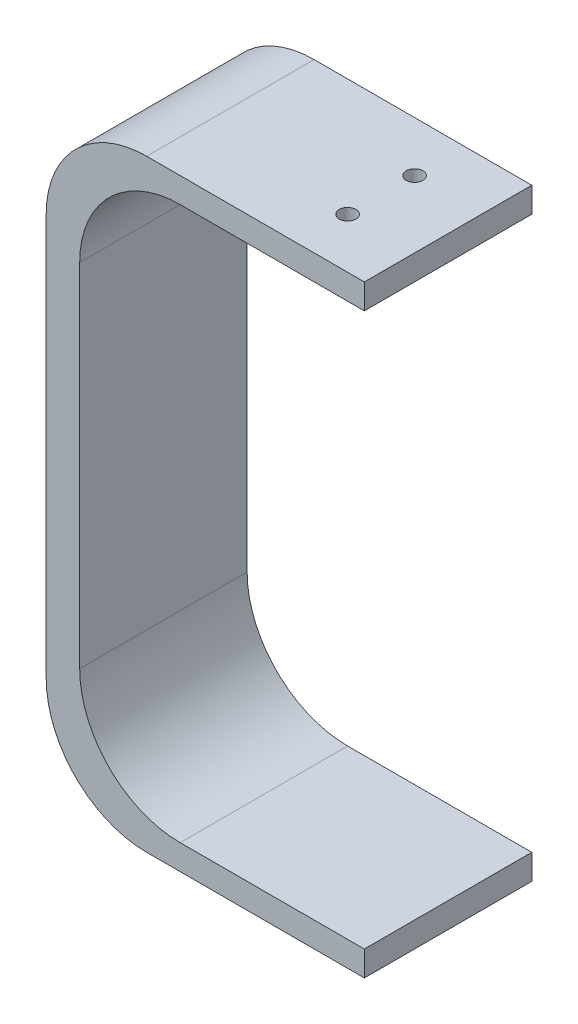
from build123d import *

# Parameters (mm, degrees)
BOSS_EXTRUDE1_DEPTH = 50
SKETCH3_R           = 2.5
CUT_EXTRUDE1_DEPTH  = 24


with BuildPart() as part:
    # Sketch1 → Boss-Extrude1 (new body)
    with BuildSketch(Plane.XY):
        with BuildLine():
            Line((-20, -165), (0, -165))
            Line((0, -165), (0, -172.5))
            Line((0, -172.5), (-51.3765108, -172.5))
            Line((-51.3765108, -172.5), (-65, -172.5))
            ThreePointArc((-65, -172.5), (-86.213203436, -163.713203436), (-95, -142.5))
            Line((-95, -142.5), (-95, -22.5))
            ThreePointArc((-95, -22.5), (-86.213203436, -1.286796564), (-65, 7.5))
            Line((-65, 7.5), (-55, 7.5))
            Line((-55, 7.5), (0, 7.5))
            Line((0, 7.5), (0, 0))
            Line((0, 0), (-55, 0))
            ThreePointArc((-55, 0), (-76.213203436, -8.786796564), (-85, -30))
            Line((-85, -30), (-85, -135))
            ThreePointArc((-85, -135), (-76.213203436, -156.213203436), (-55, -165))
            Line((-55, -165), (-20, -165))
        make_face()
    extrude(amount=BOSS_EXTRUDE1_DEPTH)

    # Sketch3 → Cut-Extrude1 (cut)
    with BuildSketch(Plane.XZ):
        with Locations(Location((-20, 35, 0), (0, 0, 270))):
            Circle(SKETCH3_R)
        with Locations(Location((-20, 15, 0), (0, 0, 270))):
            Circle(SKETCH3_R)
    extrude(amount=-CUT_EXTRUDE1_DEPTH, mode=Mode.SUBTRACT)


solid = part.part
